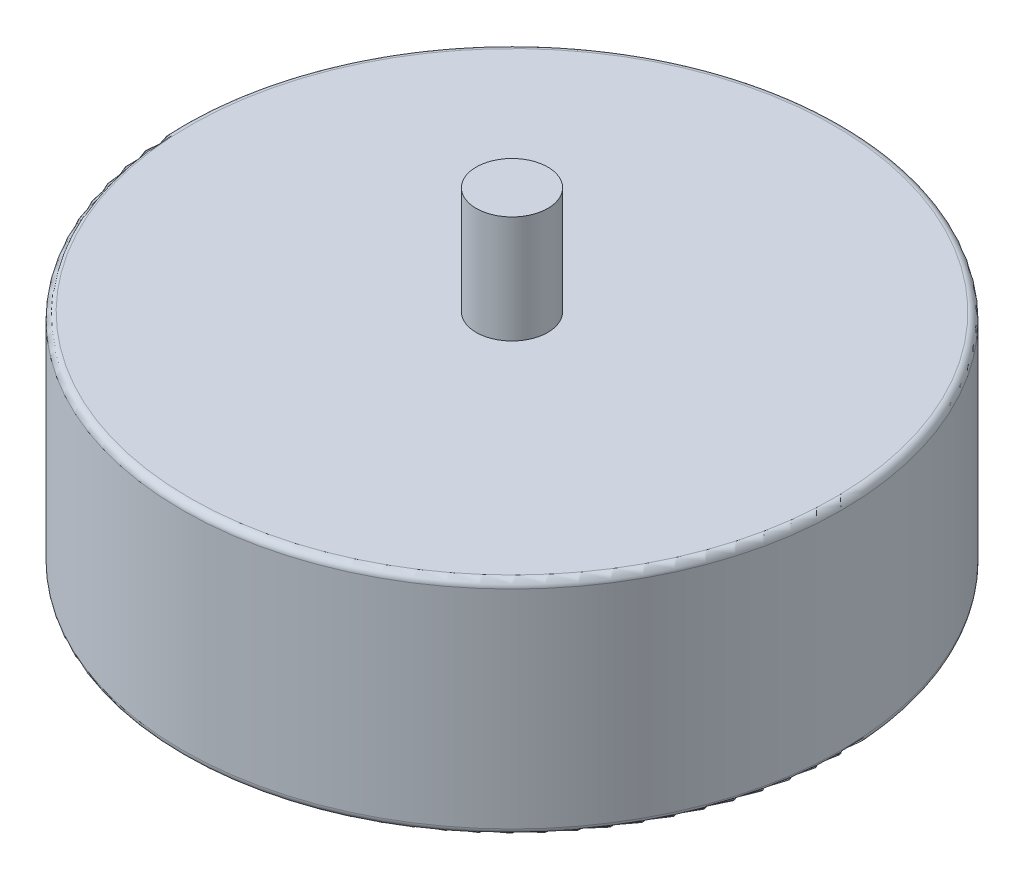
from build123d import *

# Parameters (mm, degrees)
SKETCH_1_R      = 46
EXTRUDE_1_DEPTH = 31
SKETCH_2_R      = 5
EXTRUDE_2_DEPTH = 15
FILLET_2_R      = 1


with BuildPart() as part:
    # 草图1 → 凸台-拉伸1 (new body)
    with BuildSketch(Plane(origin=(0, 0, 0), x_dir=(1, 0, 0), z_dir=(0, 1, 0))):
        with Locations(Location((0, 0, 0), (0, 0, 270))):
            Circle(SKETCH_1_R)
    extrude(amount=EXTRUDE_1_DEPTH)

    # 草图2 → 凸台-拉伸2 (add)
    with BuildSketch(Plane(origin=(0, 31, 0), x_dir=(1, 0, 0), z_dir=(0, 1, 0))):
        with Locations(Location((0, 0, 0), (0, 0, 270))):
            Circle(SKETCH_2_R)
    extrude(amount=EXTRUDE_2_DEPTH)

    # 圆角2
    fillet_2_edges = [part.edges().sort_by_distance(p)[0] for p in [
        (0, 0, -46),
        (0, 31, -46),
    ]]
    fillet(fillet_2_edges, radius=FILLET_2_R)


solid = part.part
